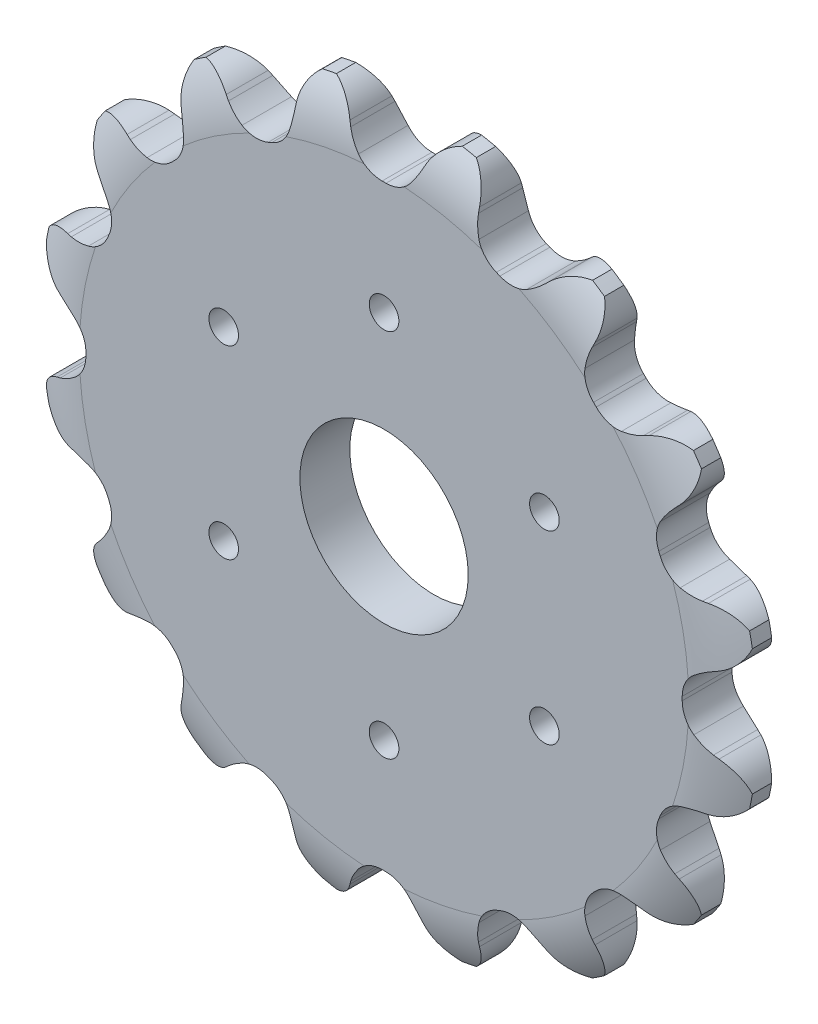
from build123d import *

# Parameters (mm, degrees)
EXTRUDE_1_DEPTH          = 7.4115
CUT_EXTRUDE_1_DEPTH      = 150.064540766
CUT_EXTRUDE_1_DEPTH_BACK = 150.064540766
SKETCH_5_R               = 25
SKETCH_5_R_2             = 4.4


with BuildPart() as part:
    # Эскиз1 → Бобышка-Вытянуть1 (new, symmetric)
    with BuildSketch(Plane.XY):
        with BuildLine():
            Line((-10.735577296, 97.010335609), (-11.315512316, 98.297743614))
            ThreePointArc((-11.315512316, 98.297743614), (-14.302459263, 102.372818667), (-18.687835245, 104.882114633))
            ThreePointArc((-18.687835245, 104.882114633), (-20.783752366, 104.486979062), (-22.871339132, 104.049963971))
            ThreePointArc((-22.871339132, 104.049963971), (-25.962632251, 100.053466054), (-27.162747691, 95.145532509))
            Line((-27.162747691, 95.145532509), (-27.205868072, 93.734191079))
            ThreePointArc((-27.205868072, 93.734191079), (-27.483402285, 90.784448928), (-28.130972017, 87.893314645))
            ThreePointArc((-28.130972017, 87.893314645), (-30.085113105, 84.377002231), (-33.367784514, 82.051665953))
            ThreePointArc((-33.367784514, 82.051665953), (-33.896950389, 81.834477351), (-34.4247027, 81.613876106))
            ThreePointArc((-34.4247027, 81.613876106), (-38.390162964, 80.936937943), (-42.258357732, 82.041559881))
            ThreePointArc((-42.258357732, 82.041559881), (-44.760599337, 83.627999589), (-47.042628339, 85.517535943))
            Line((-47.042628339, 85.517535943), (-48.071088149, 86.485014325))
            ThreePointArc((-48.071088149, 86.485014325), (-52.390131006, 89.10683765), (-57.401956111, 89.746914101))
            ThreePointArc((-57.401956111, 89.746914101), (-59.187119205, 88.579783677), (-60.948559455, 87.377149509))
            ThreePointArc((-60.948559455, 87.377149509), (-62.275148357, 82.501880221), (-61.505725594, 77.508276576))
            Line((-61.505725594, 77.508276576), (-61.005466648, 76.18786566))
            ThreePointArc((-61.005466648, 76.18786566), (-60.133057376, 73.356451515), (-59.624944606, 70.437577518))
            ThreePointArc((-59.624944606, 70.437577518), (-60.084701058, 66.44111103), (-62.227626316, 63.036556474))
            ThreePointArc((-62.227626316, 63.036556474), (-62.633397357, 62.633397357), (-63.036556474, 62.227626316))
            ThreePointArc((-63.036556474, 62.227626316), (-66.44111103, 60.084701058), (-70.437577518, 59.624944606))
            ThreePointArc((-70.437577518, 59.624944606), (-73.356451515, 60.133057376), (-76.18786566, 61.005466648))
            Line((-76.18786566, 61.005466648), (-77.508276576, 61.505725594))
            ThreePointArc((-77.508276576, 61.505725594), (-82.501880221, 62.275148357), (-87.377149509, 60.948559455))
            ThreePointArc((-87.377149509, 60.948559455), (-88.579783677, 59.187119205), (-89.746914101, 57.401956111))
            ThreePointArc((-89.746914101, 57.401956111), (-89.10683765, 52.390131006), (-86.485014325, 48.071088149))
            Line((-86.485014325, 48.071088149), (-85.517535943, 47.042628339))
            ThreePointArc((-85.517535943, 47.042628339), (-83.627999589, 44.760599337), (-82.041559881, 42.258357732))
            ThreePointArc((-82.041559881, 42.258357732), (-80.936937943, 38.390162964), (-81.613876106, 34.4247027))
            ThreePointArc((-81.613876106, 34.4247027), (-81.834477351, 33.896950389), (-82.051665953, 33.367784514))
            ThreePointArc((-82.051665953, 33.367784514), (-84.377002231, 30.085113105), (-87.893314645, 28.130972017))
            ThreePointArc((-87.893314645, 28.130972017), (-90.784448928, 27.483402285), (-93.734191079, 27.205868072))
            Line((-93.734191079, 27.205868072), (-95.145532509, 27.162747691))
            ThreePointArc((-95.145532509, 27.162747691), (-100.053466054, 25.962632251), (-104.049963971, 22.871339132))
            ThreePointArc((-104.049963971, 22.871339132), (-104.486979062, 20.783752366), (-104.882114633, 18.687835245))
            ThreePointArc((-104.882114633, 18.687835245), (-102.372818667, 14.302459263), (-98.297743614, 11.315512316))
            Line((-98.297743614, 11.315512316), (-97.010335609, 10.735577296))
            ThreePointArc((-97.010335609, 10.735577296), (-94.391336954, 9.350351666), (-91.968091372, 7.645686054))
            ThreePointArc((-91.968091372, 7.645686054), (-89.467259722, 4.494660595), (-88.57515309, 0.572))
            ThreePointArc((-88.57515309, 0.572), (-88.577, 0), (-88.57515309, -0.572))
            ThreePointArc((-88.57515309, -0.572), (-89.467259722, -4.494660595), (-91.968091372, -7.645686054))
            ThreePointArc((-91.968091372, -7.645686054), (-94.391336954, -9.350351666), (-97.010335609, -10.735577296))
            Line((-97.010335609, -10.735577296), (-98.297743614, -11.315512316))
            ThreePointArc((-98.297743614, -11.315512316), (-102.372818667, -14.302459263), (-104.882114633, -18.687835245))
            ThreePointArc((-104.882114633, -18.687835245), (-104.486979062, -20.783752366), (-104.049963971, -22.871339132))
            ThreePointArc((-104.049963971, -22.871339132), (-100.053466054, -25.962632251), (-95.145532509, -27.162747691))
            Line((-95.145532509, -27.162747691), (-93.734191079, -27.205868072))
            ThreePointArc((-93.734191079, -27.205868072), (-90.784448928, -27.483402285), (-87.893314645, -28.130972017))
            ThreePointArc((-87.893314645, -28.130972017), (-84.377002231, -30.085113105), (-82.051665953, -33.367784514))
            ThreePointArc((-82.051665953, -33.367784514), (-81.834477351, -33.896950389), (-81.613876106, -34.4247027))
            ThreePointArc((-81.613876106, -34.4247027), (-80.936937943, -38.390162964), (-82.041559881, -42.258357732))
            ThreePointArc((-82.041559881, -42.258357732), (-83.627999589, -44.760599337), (-85.517535943, -47.042628339))
            Line((-85.517535943, -47.042628339), (-86.485014325, -48.071088149))
            ThreePointArc((-86.485014325, -48.071088149), (-89.10683765, -52.390131006), (-89.746914101, -57.401956111))
            ThreePointArc((-89.746914101, -57.401956111), (-88.579783677, -59.187119205), (-87.377149509, -60.948559455))
            ThreePointArc((-87.377149509, -60.948559455), (-82.501880221, -62.275148357), (-77.508276576, -61.505725594))
            Line((-77.508276576, -61.505725594), (-76.18786566, -61.005466648))
            ThreePointArc((-76.18786566, -61.005466648), (-73.356451515, -60.133057376), (-70.437577518, -59.624944606))
            ThreePointArc((-70.437577518, -59.624944606), (-66.44111103, -60.084701058), (-63.036556474, -62.227626316))
            ThreePointArc((-63.036556474, -62.227626316), (-62.633397357, -62.633397357), (-62.227626316, -63.036556474))
            ThreePointArc((-62.227626316, -63.036556474), (-60.084701058, -66.44111103), (-59.624944606, -70.437577518))
            ThreePointArc((-59.624944606, -70.437577518), (-60.133057376, -73.356451515), (-61.005466648, -76.18786566))
            Line((-61.005466648, -76.18786566), (-61.505725594, -77.508276576))
            ThreePointArc((-61.505725594, -77.508276576), (-62.275148357, -82.501880221), (-60.948559455, -87.377149509))
            ThreePointArc((-60.948559455, -87.377149509), (-59.187119205, -88.579783677), (-57.401956111, -89.746914101))
            ThreePointArc((-57.401956111, -89.746914101), (-52.390131006, -89.10683765), (-48.071088149, -86.485014325))
            Line((-48.071088149, -86.485014325), (-47.042628339, -85.517535943))
            ThreePointArc((-47.042628339, -85.517535943), (-44.760599337, -83.627999589), (-42.258357732, -82.041559881))
            ThreePointArc((-42.258357732, -82.041559881), (-38.390162964, -80.936937943), (-34.4247027, -81.613876106))
            ThreePointArc((-34.4247027, -81.613876106), (-33.896950389, -81.834477351), (-33.367784514, -82.051665953))
            ThreePointArc((-33.367784514, -82.051665953), (-30.085113105, -84.377002231), (-28.130972017, -87.893314645))
            ThreePointArc((-28.130972017, -87.893314645), (-27.483402285, -90.784448928), (-27.205868072, -93.734191079))
            Line((-27.205868072, -93.734191079), (-27.162747691, -95.145532509))
            ThreePointArc((-27.162747691, -95.145532509), (-25.962632251, -100.053466054), (-22.871339132, -104.049963971))
            ThreePointArc((-22.871339132, -104.049963971), (-20.783752366, -104.486979062), (-18.687835245, -104.882114633))
            ThreePointArc((-18.687835245, -104.882114633), (-14.302459263, -102.372818667), (-11.315512316, -98.297743614))
            Line((-11.315512316, -98.297743614), (-10.735577296, -97.010335609))
            ThreePointArc((-10.735577296, -97.010335609), (-9.350351666, -94.391336954), (-7.645686054, -91.968091372))
            ThreePointArc((-7.645686054, -91.968091372), (-4.494660595, -89.467259722), (-0.572, -88.57515309))
            ThreePointArc((-0.572, -88.57515309), (0, -88.577), (0.572, -88.57515309))
            ThreePointArc((0.572, -88.57515309), (4.494660595, -89.467259722), (7.645686054, -91.968091372))
            ThreePointArc((7.645686054, -91.968091372), (9.350351666, -94.391336954), (10.735577296, -97.010335609))
            Line((10.735577296, -97.010335609), (11.315512316, -98.297743614))
            ThreePointArc((11.315512316, -98.297743614), (14.302459263, -102.372818667), (18.687835245, -104.882114633))
            ThreePointArc((18.687835245, -104.882114633), (20.783752366, -104.486979062), (22.871339132, -104.049963971))
            ThreePointArc((22.871339132, -104.049963971), (25.962632251, -100.053466054), (27.162747691, -95.145532509))
            Line((27.162747691, -95.145532509), (27.205868072, -93.734191079))
            ThreePointArc((27.205868072, -93.734191079), (27.483402285, -90.784448928), (28.130972017, -87.893314645))
            ThreePointArc((28.130972017, -87.893314645), (30.085113105, -84.377002231), (33.367784514, -82.051665953))
            ThreePointArc((33.367784514, -82.051665953), (33.896950389, -81.834477351), (34.4247027, -81.613876106))
            ThreePointArc((34.4247027, -81.613876106), (38.390162964, -80.936937943), (42.258357732, -82.041559881))
            ThreePointArc((42.258357732, -82.041559881), (44.760599337, -83.627999589), (47.042628339, -85.517535943))
            Line((47.042628339, -85.517535943), (48.071088149, -86.485014325))
            ThreePointArc((48.071088149, -86.485014325), (52.390131006, -89.10683765), (57.401956111, -89.746914101))
            ThreePointArc((57.401956111, -89.746914101), (59.187119205, -88.579783677), (60.948559455, -87.377149509))
            ThreePointArc((60.948559455, -87.377149509), (62.275148357, -82.501880221), (61.505725594, -77.508276576))
            Line((61.505725594, -77.508276576), (61.005466648, -76.18786566))
            ThreePointArc((61.005466648, -76.18786566), (60.133057376, -73.356451515), (59.624944606, -70.437577518))
            ThreePointArc((59.624944606, -70.437577518), (60.084701058, -66.44111103), (62.227626316, -63.036556474))
            ThreePointArc((62.227626316, -63.036556474), (62.633397357, -62.633397357), (63.036556474, -62.227626316))
            ThreePointArc((63.036556474, -62.227626316), (66.44111103, -60.084701058), (70.437577518, -59.624944606))
            ThreePointArc((70.437577518, -59.624944606), (73.356451515, -60.133057376), (76.18786566, -61.005466648))
            Line((76.18786566, -61.005466648), (77.508276576, -61.505725594))
            ThreePointArc((77.508276576, -61.505725594), (82.501880221, -62.275148357), (87.377149509, -60.948559455))
            ThreePointArc((87.377149509, -60.948559455), (88.579783677, -59.187119205), (89.746914101, -57.401956111))
            ThreePointArc((89.746914101, -57.401956111), (89.10683765, -52.390131006), (86.485014325, -48.071088149))
            Line((86.485014325, -48.071088149), (85.517535943, -47.042628339))
            ThreePointArc((85.517535943, -47.042628339), (83.627999589, -44.760599337), (82.041559881, -42.258357732))
            ThreePointArc((82.041559881, -42.258357732), (80.936937943, -38.390162964), (81.613876106, -34.4247027))
            ThreePointArc((81.613876106, -34.4247027), (81.834477351, -33.896950389), (82.051665953, -33.367784514))
            ThreePointArc((82.051665953, -33.367784514), (84.377002231, -30.085113105), (87.893314645, -28.130972017))
            ThreePointArc((87.893314645, -28.130972017), (90.784448928, -27.483402285), (93.734191079, -27.205868072))
            Line((93.734191079, -27.205868072), (95.145532509, -27.162747691))
            ThreePointArc((95.145532509, -27.162747691), (100.053466054, -25.962632251), (104.049963971, -22.871339132))
            ThreePointArc((104.049963971, -22.871339132), (104.486979062, -20.783752366), (104.882114633, -18.687835245))
            ThreePointArc((104.882114633, -18.687835245), (102.372818667, -14.302459263), (98.297743614, -11.315512316))
            Line((98.297743614, -11.315512316), (97.010335609, -10.735577296))
            ThreePointArc((97.010335609, -10.735577296), (94.391336954, -9.350351666), (91.968091372, -7.645686054))
            ThreePointArc((91.968091372, -7.645686054), (89.467259722, -4.494660595), (88.57515309, -0.572))
            ThreePointArc((88.57515309, -0.572), (88.577, 0), (88.57515309, 0.572))
            ThreePointArc((88.57515309, 0.572), (89.467259722, 4.494660595), (91.968091372, 7.645686054))
            ThreePointArc((91.968091372, 7.645686054), (94.391336954, 9.350351666), (97.010335609, 10.735577296))
            Line((97.010335609, 10.735577296), (98.297743614, 11.315512316))
            ThreePointArc((98.297743614, 11.315512316), (102.372818667, 14.302459263), (104.882114633, 18.687835245))
            ThreePointArc((104.882114633, 18.687835245), (104.486979062, 20.783752366), (104.049963971, 22.871339132))
            ThreePointArc((104.049963971, 22.871339132), (100.053466054, 25.962632251), (95.145532509, 27.162747691))
            Line((95.145532509, 27.162747691), (93.734191079, 27.205868072))
            ThreePointArc((93.734191079, 27.205868072), (90.784448928, 27.483402285), (87.893314645, 28.130972017))
            ThreePointArc((87.893314645, 28.130972017), (84.377002231, 30.085113105), (82.051665953, 33.367784514))
            ThreePointArc((82.051665953, 33.367784514), (81.834477351, 33.896950389), (81.613876106, 34.4247027))
            ThreePointArc((81.613876106, 34.4247027), (80.936937943, 38.390162964), (82.041559881, 42.258357732))
            ThreePointArc((82.041559881, 42.258357732), (83.627999589, 44.760599337), (85.517535943, 47.042628339))
            Line((85.517535943, 47.042628339), (86.485014325, 48.071088149))
            ThreePointArc((86.485014325, 48.071088149), (89.10683765, 52.390131006), (89.746914101, 57.401956111))
            ThreePointArc((89.746914101, 57.401956111), (88.579783677, 59.187119205), (87.377149509, 60.948559455))
            ThreePointArc((87.377149509, 60.948559455), (82.501880221, 62.275148357), (77.508276576, 61.505725594))
            Line((77.508276576, 61.505725594), (76.18786566, 61.005466648))
            ThreePointArc((76.18786566, 61.005466648), (73.356451515, 60.133057376), (70.437577518, 59.624944606))
            ThreePointArc((70.437577518, 59.624944606), (66.44111103, 60.084701058), (63.036556474, 62.227626316))
            ThreePointArc((63.036556474, 62.227626316), (62.633397357, 62.633397357), (62.227626316, 63.036556474))
            ThreePointArc((62.227626316, 63.036556474), (60.084701058, 66.44111103), (59.624944606, 70.437577518))
            ThreePointArc((59.624944606, 70.437577518), (60.133057376, 73.356451515), (61.005466648, 76.18786566))
            Line((61.005466648, 76.18786566), (61.505725594, 77.508276576))
            ThreePointArc((61.505725594, 77.508276576), (62.275148357, 82.501880221), (60.948559455, 87.377149509))
            ThreePointArc((60.948559455, 87.377149509), (59.187119205, 88.579783677), (57.401956111, 89.746914101))
            ThreePointArc((57.401956111, 89.746914101), (52.390131006, 89.10683765), (48.071088149, 86.485014325))
            Line((48.071088149, 86.485014325), (47.042628339, 85.517535943))
            ThreePointArc((47.042628339, 85.517535943), (44.760599337, 83.627999589), (42.258357732, 82.041559881))
            ThreePointArc((42.258357732, 82.041559881), (38.390162964, 80.936937943), (34.4247027, 81.613876106))
            ThreePointArc((34.4247027, 81.613876106), (33.896950389, 81.834477351), (33.367784514, 82.051665953))
            ThreePointArc((33.367784514, 82.051665953), (30.085113105, 84.377002231), (28.130972017, 87.893314645))
            ThreePointArc((28.130972017, 87.893314645), (27.483402285, 90.784448928), (27.205868072, 93.734191079))
            Line((27.205868072, 93.734191079), (27.162747691, 95.145532509))
            ThreePointArc((27.162747691, 95.145532509), (25.962632251, 100.053466054), (22.871339132, 104.049963971))
            ThreePointArc((22.871339132, 104.049963971), (20.783752366, 104.486979062), (18.687835245, 104.882114633))
            ThreePointArc((18.687835245, 104.882114633), (14.302459263, 102.372818667), (11.315512316, 98.297743614))
            Line((11.315512316, 98.297743614), (10.735577296, 97.010335609))
            ThreePointArc((10.735577296, 97.010335609), (9.350351666, 94.391336954), (7.645686054, 91.968091372))
            ThreePointArc((7.645686054, 91.968091372), (4.494660595, 89.467259722), (0.572, 88.57515309))
            ThreePointArc((0.572, 88.57515309), (0, 88.577), (-0.572, 88.57515309))
            ThreePointArc((-0.572, 88.57515309), (-4.494660595, 89.467259722), (-7.645686054, 91.968091372))
            ThreePointArc((-7.645686054, 91.968091372), (-9.350351666, 94.391336954), (-10.735577296, 97.010335609))
        make_face()
    extrude(amount=EXTRUDE_1_DEPTH, both=True)

    # Эскиз4 → Вырез-Повернуть1 (revolve, cut)
    with BuildSketch(Plane(origin=(0, 0, 0), x_dir=(0, 0, -1), z_dir=(1, 0, 0))):
        with BuildLine():
            Line((-7.4115, 90.522114633), (-15.520402378, 90.522114633))
            Line((-15.520402378, 90.522114633), (-15.520402378, 116.779677))
            Line((-15.520402378, 116.779677), (14.220703927, 116.779677))
            Line((14.220703927, 116.779677), (14.220703927, 90.522114633))
            Line((14.220703927, 90.522114633), (7.4115, 90.522114633))
            ThreePointArc((7.4115, 90.522114633), (5.498672361, 101.156067861), (0, 110.456845952))
            ThreePointArc((0, 110.456845952), (-5.498672361, 101.156067861), (-7.4115, 90.522114633))
        make_face()
    revolve(axis=Axis((0, 0, 0), (0, 0, -1)), mode=Mode.SUBTRACT)

    # Эскиз5 → Вырез-Вытянуть1 (cut, two sides: drawn at the far end of the back side and taken through both)
    with BuildSketch(Plane.XY.offset(7.4115).offset(-CUT_EXTRUDE_1_DEPTH_BACK)):
        Circle(SKETCH_5_R)
        with Locations((0, 55)):
            Circle(SKETCH_5_R_2)
        with Locations((47.631397208, 27.5)):
            Circle(SKETCH_5_R_2)
        with Locations((47.631397208, -27.5)):
            Circle(SKETCH_5_R_2)
        with Locations((0, -55)):
            Circle(SKETCH_5_R_2)
        with Locations((-47.631397208, -27.5)):
            Circle(SKETCH_5_R_2)
        with Locations((-47.631397208, 27.5)):
            Circle(SKETCH_5_R_2)
    extrude(amount=CUT_EXTRUDE_1_DEPTH + CUT_EXTRUDE_1_DEPTH_BACK, mode=Mode.SUBTRACT)


solid = part.part
